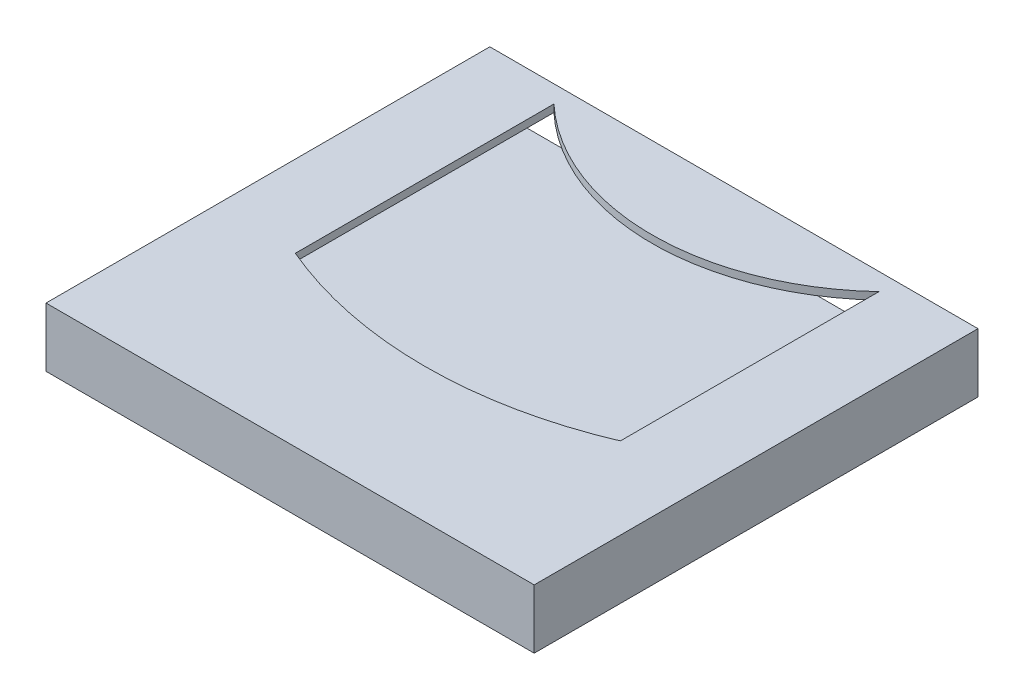
from build123d import *

# Parameters (mm, degrees)
SKETCH_1_W          = 33
SKETCH_1_H          = 30
EXTRUDE_1_DEPTH     = 4
SHELL_1_T           = -0.5
CUT_EXTRUDE_2_DEPTH = 1


with BuildPart() as part:
    # 草图1 → 拉伸1 (new body)
    with BuildSketch(Plane(origin=(0, 0, 0), x_dir=(1, 0, 0), z_dir=(0, 1, 0))):
        Rectangle(SKETCH_1_W, SKETCH_1_H)
    extrude(amount=EXTRUDE_1_DEPTH)

    # 抽壳1
    shell_1_openings = [part.faces().sort_by_distance(p)[0] for p in [
        (0, 2, -15),
    ]]
    offset(amount=SHELL_1_T, openings=shell_1_openings, kind=Kind.INTERSECTION)

    # 草图2 → 切除-拉伸2 (cut)
    with BuildSketch(Plane(origin=(0, 4, 0), x_dir=(-1, 0, 0), z_dir=(0, 1, 0))):
        with BuildLine():
            Line((10.985566132, -13.819893674), (10.985566132, 3.658083867))
            ThreePointArc((10.985566132, 3.658083867), (0, 5.904035161), (-10.985566132, 3.658083867))
            Line((-10.985566132, 3.658083867), (-10.985566132, -13.819893674))
            ThreePointArc((-10.985566132, -13.819893674), (0, -9.472380487), (10.985566132, -13.819893674))
        make_face()
    extrude(amount=-CUT_EXTRUDE_2_DEPTH, mode=Mode.SUBTRACT)


solid = part.part
